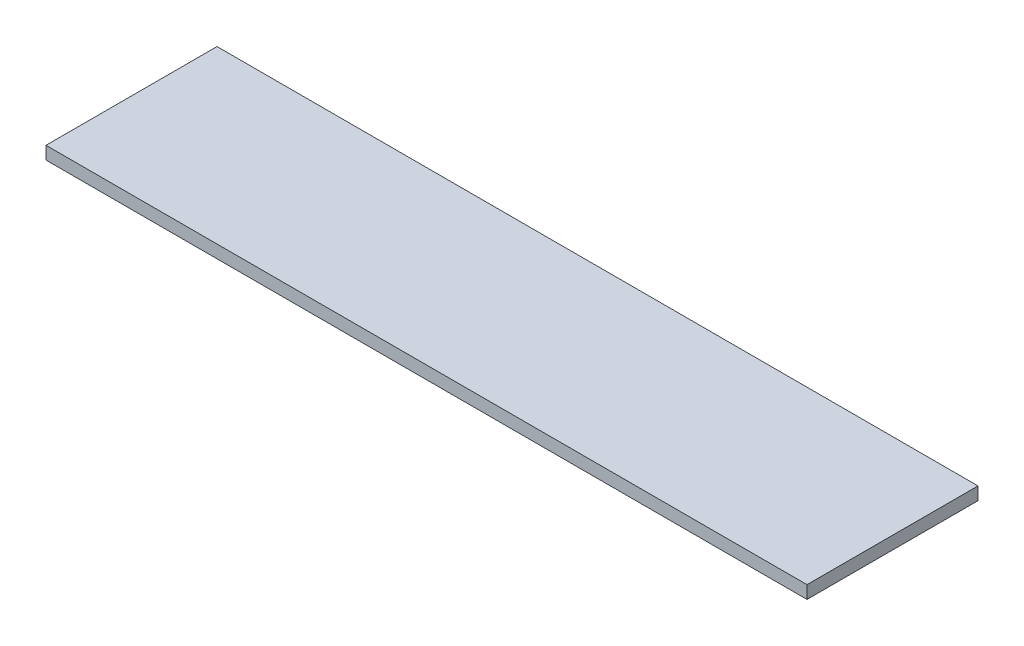
from build123d import *

# Parameters (mm, degrees)
SKETCH1_W           = 89
SKETCH1_H           = 20
BOSS_EXTRUDE1_DEPTH = 1.5


with BuildPart() as part:
    # Sketch1 → Boss-Extrude1 (new body)
    with BuildSketch(Plane(origin=(0, 0, 0), x_dir=(1, 0, 0), z_dir=(0, 1, 0))):
        Rectangle(SKETCH1_W, SKETCH1_H)
    extrude(amount=BOSS_EXTRUDE1_DEPTH)


solid = part.part
